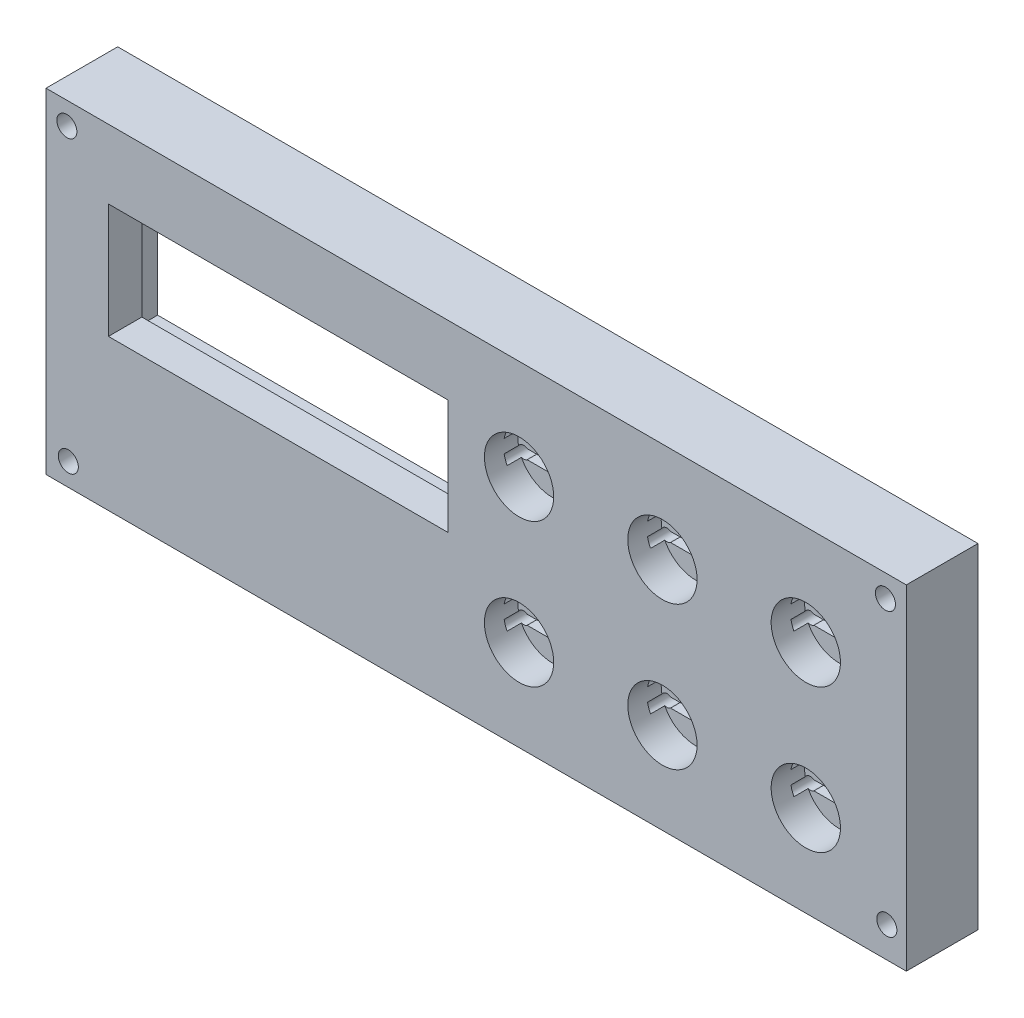
from build123d import *

# Parameters (mm, degrees)
SKETCH_1_W               = 180
SKETCH_1_H               = 70
EXTRUDE_1_DEPTH          = 15
SKETCH_2_R               = 2.1
SKETCH_2_W               = 71
SKETCH_2_H               = 24
CUT_EXTRUDE_1_DEPTH      = 194.713706278
SKETCH_5_W               = 80.4
SKETCH_5_H               = 36
SKETCH_5_W_2             = 71
SKETCH_5_H_2             = 24
CUT_EXTRUDE_3_DEPTH      = 8
SKETCH_6_W               = 4.7
SKETCH_6_H               = 24
CUT_EXTRUDE_4_DEPTH      = 3
SKETCH_7_R               = 7.25
CUT_EXTRUDE_5_DEPTH      = 7
CUT_EXTRUDE_6_DEPTH      = 4.2
CUT_EXTRUDE_7_DEPTH      = 3
CUT_EXTRUDE_7_DEPTH_BACK = 194.297697865
SKETCH_9_R               = 1.25
CUT_EXTRUDE_8_DEPTH      = 13
CUT_EXTRUDE_10_DEPTH     = 12


with BuildPart() as part:
    # 草图1 → 凸台-拉伸1 (new body)
    with BuildSketch(Plane.XY):
        with Locations((90, 35)):
            Rectangle(SKETCH_1_W, SKETCH_1_H)
    extrude(amount=EXTRUDE_1_DEPTH)

    # 草图2 → 切除-拉伸1 (cut, through all)
    with BuildSketch(Plane.XY.offset(15)):
        with Locations((4.367458012, 65.325340213)):
            Circle(SKETCH_2_R)
        with Locations(Location((175.632541988, 65.325340213, 0), (0, 0, 180))):
            Circle(SKETCH_2_R)
        with Locations((175.923124979, 6.408564886)):
            Circle(SKETCH_2_R)
        with Locations(Location((4.666373031, 4.719215478, 0), (0, 0, 180))):
            Circle(SKETCH_2_R)
        with Locations((48.558725391, 43.555444336)):
            Rectangle(SKETCH_2_W, SKETCH_2_H)
    extrude(amount=-CUT_EXTRUDE_1_DEPTH, mode=Mode.SUBTRACT)

    # 草图5 → 切除-拉伸3 (cut)
    with BuildSketch(Plane(origin=(0, 0, 0), x_dir=(-1, 0, 0), z_dir=(0, 0, -1))):
        with Locations((-48.558725391, 43.555444336)):
            Rectangle(SKETCH_5_W, SKETCH_5_H)
        with Locations((-48.558725391, 43.555444336)):
            Rectangle(SKETCH_5_W_2, SKETCH_5_H_2, mode=Mode.SUBTRACT)
    extrude(amount=-CUT_EXTRUDE_3_DEPTH, mode=Mode.SUBTRACT)

    # 草图6 → 切除-拉伸4 (cut)
    with BuildSketch(Plane(origin=(0, 0, 8), x_dir=(-1, 0, 0), z_dir=(0, 0, -1))):
        with Locations((-86.408725391, 43.555444336)):
            Rectangle(SKETCH_6_W, SKETCH_6_H)
    extrude(amount=-CUT_EXTRUDE_4_DEPTH, mode=Mode.SUBTRACT)

    # 草图7 → 切除-拉伸5 (cut)
    with BuildSketch(Plane.XY.offset(15)):
        with Locations((98.972752909, 49.067651319)):
            Circle(SKETCH_7_R)
        with Locations((128.972752909, 49.067651319)):
            Circle(SKETCH_7_R)
        with Locations((158.972752909, 49.067651319)):
            Circle(SKETCH_7_R)
        with Locations((128.972752909, 19.067651319)):
            Circle(SKETCH_7_R)
        with Locations((158.972752909, 19.067651319)):
            Circle(SKETCH_7_R)
        with Locations((98.972752909, 19.067651319)):
            Circle(SKETCH_7_R)
    extrude(amount=-CUT_EXTRUDE_5_DEPTH, mode=Mode.SUBTRACT)

    # 草图8 → 切除-拉伸6 (cut)
    with BuildSketch(Plane.XY.offset(8)):
        Polygon((95.922752909, 48.017651319), (92.922752909, 48.017651319), (92.922752909, 46.017651319), (95.922752909, 46.017651319), (102.022752909, 46.017651319), (105.022752909, 46.017651319), (105.022752909, 48.017651319), (102.022752909, 48.017651319), (102.022752909, 50.117651319), (105.022752909, 50.117651319), (105.022752909, 52.117651319), (102.022752909, 52.117651319), (95.922752909, 52.117651319), (92.922752909, 52.117651319), (92.922752909, 50.117651319), (95.922752909, 50.117651319), align=None)
        Polygon((125.922752909, 52.117651319), (132.022752909, 52.117651319), (135.022752909, 52.117651319), (135.022752909, 50.117651319), (132.022752909, 50.117651319), (132.022752909, 48.017651319), (135.022752909, 48.017651319), (135.022752909, 46.017651319), (132.022752909, 46.017651319), (125.922752909, 46.017651319), (122.922752909, 46.017651319), (122.922752909, 48.017651319), (125.922752909, 48.017651319), (125.922752909, 50.117651319), (122.922752909, 50.117651319), (122.922752909, 52.117651319), align=None)
        Polygon((155.922752909, 52.117651319), (162.022752909, 52.117651319), (165.022752909, 52.117651319), (165.022752909, 50.117651319), (162.022752909, 50.117651319), (162.022752909, 48.017651319), (165.022752909, 48.017651319), (165.022752909, 46.017651319), (162.022752909, 46.017651319), (155.922752909, 46.017651319), (152.922752909, 46.017651319), (152.922752909, 48.017651319), (155.922752909, 48.017651319), (155.922752909, 50.117651319), (152.922752909, 50.117651319), (152.922752909, 52.117651319), align=None)
        Polygon((125.922752909, 22.117651319), (132.022752909, 22.117651319), (135.022752909, 22.117651319), (135.022752909, 20.117651319), (132.022752909, 20.117651319), (132.022752909, 18.017651319), (135.022752909, 18.017651319), (135.022752909, 16.017651319), (132.022752909, 16.017651319), (125.922752909, 16.017651319), (122.922752909, 16.017651319), (122.922752909, 18.017651319), (125.922752909, 18.017651319), (125.922752909, 20.117651319), (122.922752909, 20.117651319), (122.922752909, 22.117651319), align=None)
        Polygon((155.922752909, 22.117651319), (162.022752909, 22.117651319), (165.022752909, 22.117651319), (165.022752909, 20.117651319), (162.022752909, 20.117651319), (162.022752909, 18.017651319), (165.022752909, 18.017651319), (165.022752909, 16.017651319), (162.022752909, 16.017651319), (155.922752909, 16.017651319), (152.922752909, 16.017651319), (152.922752909, 18.017651319), (155.922752909, 18.017651319), (155.922752909, 20.117651319), (152.922752909, 20.117651319), (152.922752909, 22.117651319), align=None)
        Polygon((95.922752909, 22.117651319), (102.022752909, 22.117651319), (105.022752909, 22.117651319), (105.022752909, 20.117651319), (102.022752909, 20.117651319), (102.022752909, 18.017651319), (105.022752909, 18.017651319), (105.022752909, 16.017651319), (102.022752909, 16.017651319), (95.922752909, 16.017651319), (92.922752909, 16.017651319), (92.922752909, 18.017651319), (95.922752909, 18.017651319), (95.922752909, 20.117651319), (92.922752909, 20.117651319), (92.922752909, 22.117651319), align=None)
    extrude(amount=-CUT_EXTRUDE_6_DEPTH, mode=Mode.SUBTRACT)

    # 草图9 → 切除-拉伸7 (cut, two sides: drawn at the far end of the back side and taken through both)
    with BuildSketch(Plane.XY.offset(8).offset(-CUT_EXTRUDE_7_DEPTH_BACK)):
        with Locations(Location((92.922752909, 51.117651319, 0), (0, 0, 211.60905321))):
            Circle(SKETCH_9_R)
        with Locations(Location((105.022752909, 51.117651319, 0), (0, 0, 180))):
            Circle(SKETCH_9_R)
        with Locations(Location((105.022752909, 47.017651319, 0), (0, 0, 233.130102354))):
            Circle(SKETCH_9_R)
        with Locations(Location((92.922752909, 47.017651319, 0), (0, 0, 180))):
            Circle(SKETCH_9_R)
        with Locations(Location((122.922752909, 51.117651319, 0), (0, 0, 211.60905321))):
            Circle(SKETCH_9_R)
        with Locations(Location((135.022752909, 51.117651319, 0), (0, 0, 180))):
            Circle(SKETCH_9_R)
        with Locations(Location((135.022752909, 47.017651319, 0), (0, 0, 233.130102354))):
            Circle(SKETCH_9_R)
        with Locations(Location((122.922752909, 47.017651319, 0), (0, 0, 180))):
            Circle(SKETCH_9_R)
        with Locations(Location((152.922752909, 51.117651319, 0), (0, 0, 211.60905321))):
            Circle(SKETCH_9_R)
        with Locations(Location((165.022752909, 51.117651319, 0), (0, 0, 180))):
            Circle(SKETCH_9_R)
        with Locations(Location((165.022752909, 47.017651319, 0), (0, 0, 233.130102354))):
            Circle(SKETCH_9_R)
        with Locations(Location((152.922752909, 47.017651319, 0), (0, 0, 180))):
            Circle(SKETCH_9_R)
        with Locations(Location((122.922752909, 21.117651319, 0), (0, 0, 211.60905321))):
            Circle(SKETCH_9_R)
        with Locations(Location((135.022752909, 21.117651319, 0), (0, 0, 180))):
            Circle(SKETCH_9_R)
        with Locations(Location((135.022752909, 17.017651319, 0), (0, 0, 233.130102354))):
            Circle(SKETCH_9_R)
        with Locations(Location((122.922752909, 17.017651319, 0), (0, 0, 180))):
            Circle(SKETCH_9_R)
        with Locations(Location((152.922752909, 21.117651319, 0), (0, 0, 211.60905321))):
            Circle(SKETCH_9_R)
        with Locations(Location((165.022752909, 21.117651319, 0), (0, 0, 180))):
            Circle(SKETCH_9_R)
        with Locations(Location((165.022752909, 17.017651319, 0), (0, 0, 233.130102354))):
            Circle(SKETCH_9_R)
        with Locations(Location((152.922752909, 17.017651319, 0), (0, 0, 180))):
            Circle(SKETCH_9_R)
        with Locations(Location((92.922752909, 21.117651319, 0), (0, 0, 211.60905321))):
            Circle(SKETCH_9_R)
        with Locations(Location((105.022752909, 21.117651319, 0), (0, 0, 180))):
            Circle(SKETCH_9_R)
        with Locations(Location((105.022752909, 17.017651319, 0), (0, 0, 233.130102354))):
            Circle(SKETCH_9_R)
        with Locations(Location((92.922752909, 17.017651319, 0), (0, 0, 180))):
            Circle(SKETCH_9_R)
    extrude(amount=CUT_EXTRUDE_7_DEPTH + CUT_EXTRUDE_7_DEPTH_BACK, mode=Mode.SUBTRACT)

    # 草图10 → 切除-拉伸8 (cut)
    with BuildSketch(Plane(origin=(0, 0, 0), x_dir=(-1, 0, 0), z_dir=(0, 0, -1))):
        Polygon((-171.002219313, 67.469244028), (-9.134493294, 67.469244028), (-9.134493294, 64.32485408), (-92.255758006, 64.32485408), (-92.255758006, 58.58292461), (-168.404679791, 58.58292461), (-168.404679791, 10.323374538), (-88.564517632, 10.323374538), (-88.564517632, 21.807233479), (-6.536953771, 21.807233479), (-6.536953771, 60.633613707), (-3.11913861, 60.633613707), (-3.11913861, 21.807233479), (-3.11913861, 10.323374538), (-10.228194145, 10.323374538), (-10.228194145, 3.214319004), (-171.002219313, 3.214319004), (-171.002219313, 10.323374538), (-177.154286602, 10.323374538), (-177.154286602, 58.58292461), (-171.002219313, 58.58292461), align=None)
    extrude(amount=-CUT_EXTRUDE_8_DEPTH, mode=Mode.SUBTRACT)

    # 草图11 → 切除-拉伸10 (cut)
    with BuildSketch(Plane(origin=(0, 0, 0), x_dir=(-1, 0, 0), z_dir=(0, 0, -1))):
        Polygon((-148.164518432, 58.58292461), (-139.298967681, 58.58292461), (-139.298967681, 39.728582059), (-118.284328862, 39.728582059), (-118.284328862, 58.58292461), (-109.199875623, 58.58292461), (-109.199875623, 39.728582059), (-91.030969144, 39.728582059), (-91.030969144, 28.67400643), (-109.199875623, 28.67400643), (-109.199875623, 10.323374538), (-118.284328862, 10.323374538), (-118.284328862, 28.67400643), (-139.298967681, 28.67400643), (-139.298967681, 10.323374538), (-148.164518432, 10.323374538), (-148.164518432, 28.67400643), (-168.404679791, 28.67400643), (-168.404679791, 39.728582059), (-148.164518432, 39.728582059), align=None)
    extrude(amount=-CUT_EXTRUDE_10_DEPTH, mode=Mode.SUBTRACT)


solid = part.part
